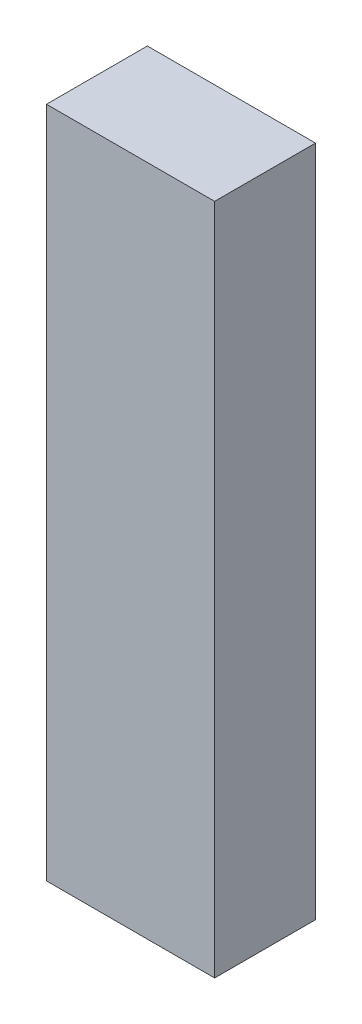
from build123d import *

# Parameters (mm, degrees)
CROQUIS1_W              = 25
CROQUIS1_H              = 15
SALIENTE_EXTRUIR1_DEPTH = 100


with BuildPart() as part:
    # Croquis1 → Saliente-Extruir1 (new body)
    with BuildSketch(Plane(origin=(0, 0, 0), x_dir=(1, 0, 0), z_dir=(0, 1, 0))):
        Rectangle(CROQUIS1_W, CROQUIS1_H)
    extrude(amount=SALIENTE_EXTRUIR1_DEPTH)


solid = part.part
